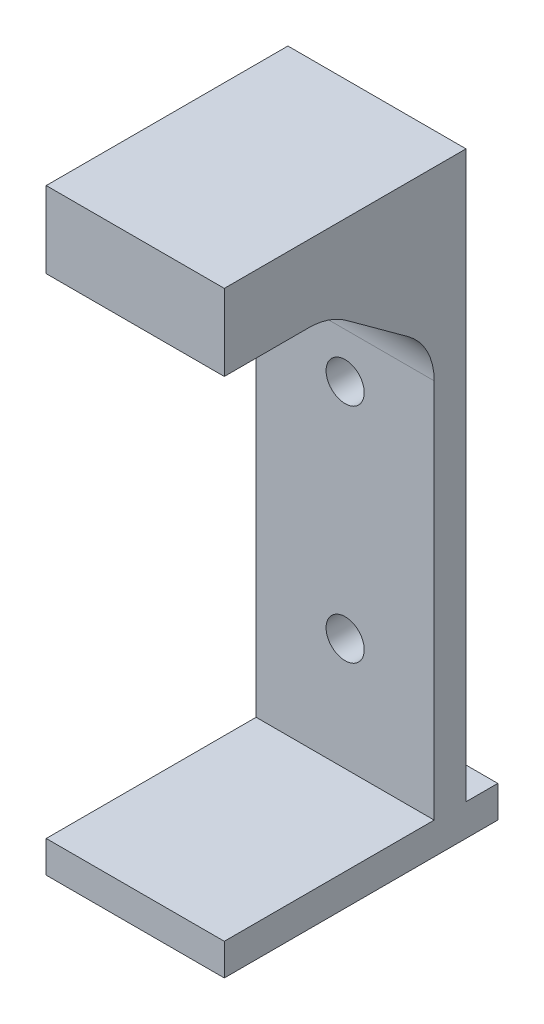
from build123d import *

# Parameters (mm, degrees)
SKETCH1_W                = 14
SKETCH1_H                = 28.85
SKETCH1_R                = 1.5
BOSS_EXTRUDE1_DEPTH      = 2.5
BOSS_EXTRUDE2_DEPTH      = 16.5
BOSS_EXTRUDE2_DEPTH_BACK = 5
SKETCH3_W                = 14
SKETCH3_H                = 2
SKETCH4_W                = 14
SKETCH4_H                = 2.5
BOSS_EXTRUDE3_DEPTH      = 15.6
SKETCH5_W                = 14
SKETCH5_H                = 2.5
BOSS_EXTRUDE4_DEPTH      = 21.5
SKETCH6_W                = 14
SKETCH6_H                = 6
BOSS_EXTRUDE5_DEPTH      = 16.5
BOSS_EXTRUDE6_DEPTH      = 14
FILLET2_R                = 5


with BuildPart() as part:
    # Sketch1 → Boss-Extrude1 (new body)
    with BuildSketch(Plane.XY):
        with Locations((7, 14.425)):
            Rectangle(SKETCH1_W, SKETCH1_H)
        with Locations((7, 26.35)):
            Circle(SKETCH1_R, mode=Mode.SUBTRACT)
        with Locations((7, 8.85)):
            Circle(SKETCH1_R, mode=Mode.SUBTRACT)
    extrude(amount=BOSS_EXTRUDE1_DEPTH)

    # Sketch3 → Boss-Extrude2 (add, two sides: drawn at the far end of the back side and taken through both)
    with BuildSketch(Plane.XY.offset(2.5).offset(-BOSS_EXTRUDE2_DEPTH_BACK)):
        with Locations((7, -1)):
            Rectangle(SKETCH3_W, SKETCH3_H)
    extrude(amount=BOSS_EXTRUDE2_DEPTH + BOSS_EXTRUDE2_DEPTH_BACK)

    # Sketch4 → Boss-Extrude3 (add)
    with BuildSketch(Plane(origin=(0, 28.85, 0), x_dir=(1, 0, 0), z_dir=(0, 1, 0))):
        with Locations((7, -1.25)):
            Rectangle(SKETCH4_W, SKETCH4_H)
    extrude(amount=BOSS_EXTRUDE3_DEPTH)

    # Sketch5 → Boss-Extrude4 (add)
    with BuildSketch(Plane.XY.offset(19)):
        with Locations((7, -1.25)):
            Rectangle(SKETCH5_W, SKETCH5_H)
    extrude(amount=-BOSS_EXTRUDE4_DEPTH)

    # Sketch6 → Boss-Extrude5 (add)
    with BuildSketch(Plane.XY.offset(2.5)):
        with Locations((7, 41.45)):
            Rectangle(SKETCH6_W, SKETCH6_H)
    extrude(amount=BOSS_EXTRUDE5_DEPTH)

    # Sketch7 → Boss-Extrude6 (add)
    with BuildSketch(Plane(origin=(14, 0, 0), x_dir=(0, 0, -1), z_dir=(1, 0, 0))):
        Polygon((-10.75, 38.45), (-2.5, 32.45), (-2.5, 38.45), align=None)
    extrude(amount=-BOSS_EXTRUDE6_DEPTH)

    # Fillet2
    fillet2_edges = [part.edges().sort_by_distance(p)[0] for p in [
        (7, 38.45, 10.75),
        (7, 32.45, 2.5),
    ]]
    fillet(fillet2_edges, radius=FILLET2_R)


solid = part.part
